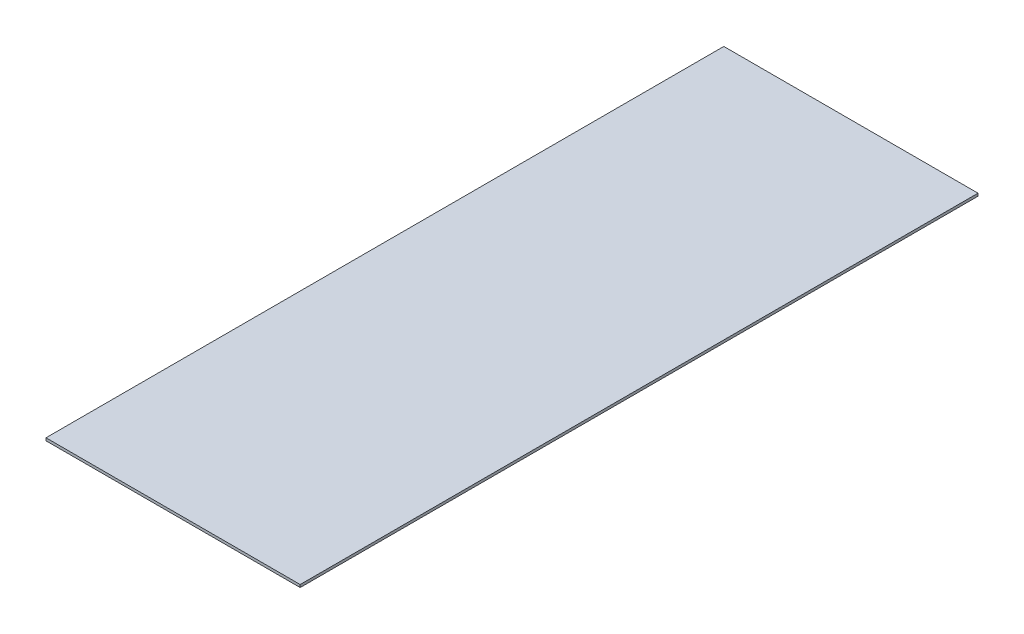
from build123d import *

# Parameters (mm, degrees)
CROQUIS1_W              = 914.4
CROQUIS1_H              = 2438.4
SALIENTE_EXTRUIR1_DEPTH = 9.5


with BuildPart() as part:
    # Croquis1 → Saliente-Extruir1 (new body)
    with BuildSketch(Plane(origin=(0, 0, 0), x_dir=(1, 0, 0), z_dir=(0, 1, 0))):
        Rectangle(CROQUIS1_W, CROQUIS1_H)
    extrude(amount=SALIENTE_EXTRUIR1_DEPTH)


solid = part.part
